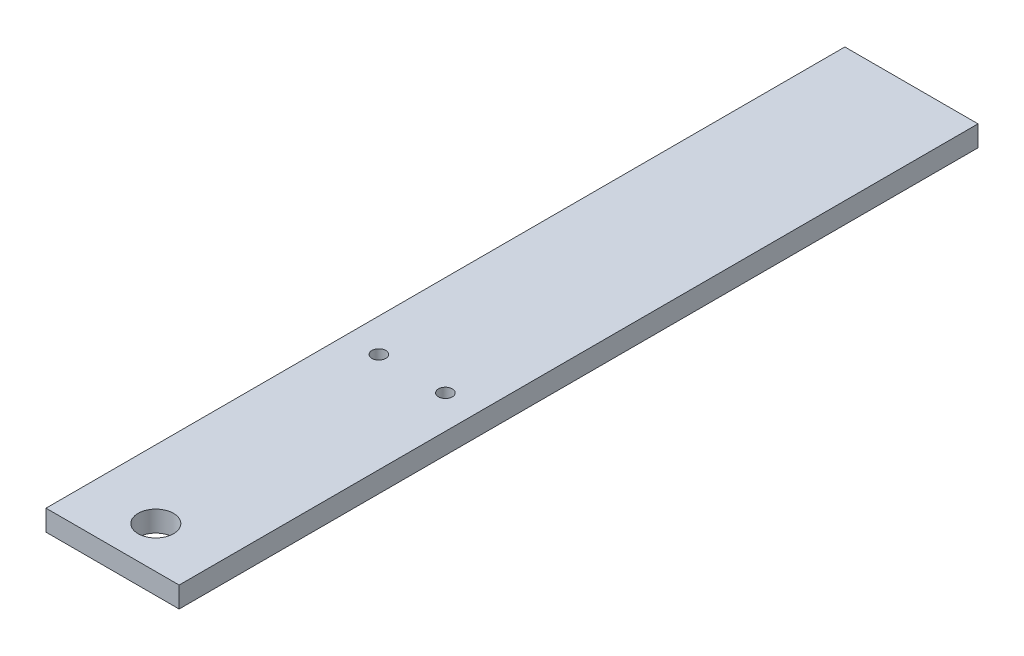
from build123d import *

# Parameters (mm, degrees)
BOSS_EXTRUDE1_DEPTH                             = 76.2
BOSS_EXTRUDE1_DEPTH_BACK                        = 76.2
SKETCH3_W                                       = 50.8
SKETCH3_H                                       = 7.9375
M12_CLEARANCE_HOLE2_D                           = 13.5
CSK_FOR_M5_FLAT_HEAD_MACHINE_SCREW1_D           = 5.3
CSK_FOR_M5_FLAT_HEAD_MACHINE_SCREW1_CSINK_D     = 10.4
CSK_FOR_M5_FLAT_HEAD_MACHINE_SCREW1_CSINK_ANGLE = 90
SKETCH26_W                                      = 50.8
SKETCH26_H                                      = 152.4
BOSS_EXTRUDE2_DEPTH                             = 7.9375


with BuildPart() as part:
    # Sketch3 → Boss-Extrude1 (new, two sides: drawn at the far end of the back side and taken through both)
    with BuildSketch(Plane.XY.offset(-BOSS_EXTRUDE1_DEPTH_BACK)):
        Rectangle(SKETCH3_W, SKETCH3_H)
    extrude(amount=BOSS_EXTRUDE1_DEPTH + BOSS_EXTRUDE1_DEPTH_BACK)

    # M12 Clearance Hole2 (through all)
    with Locations(Plane(origin=(0, 3.96875, 0), x_dir=(1, 0, 0), z_dir=(0, 1, 0))):
        with Locations((0.625840615, -60.325)):
            Hole(M12_CLEARANCE_HOLE2_D / 2)

    # CSK for M5 Flat Head Machine Screw1 (through all)
    with Locations(Plane(origin=(0, -3.96875, 0), x_dir=(-1, 0, 0), z_dir=(0, -1, 0))):
        with Locations((-12.7, 38.1), (12.7, 38.1)):
            CounterSinkHole(CSK_FOR_M5_FLAT_HEAD_MACHINE_SCREW1_D / 2, CSK_FOR_M5_FLAT_HEAD_MACHINE_SCREW1_CSINK_D / 2, counter_sink_angle=CSK_FOR_M5_FLAT_HEAD_MACHINE_SCREW1_CSINK_ANGLE)

    # Sketch26 → Boss-Extrude2 (add)
    with BuildSketch(Plane(origin=(0, 3.96875, 0), x_dir=(1, 0, 0), z_dir=(0, 1, 0))):
        with Locations((0, 152.4)):
            Rectangle(SKETCH26_W, SKETCH26_H)
    extrude(amount=-BOSS_EXTRUDE2_DEPTH)


solid = part.part
